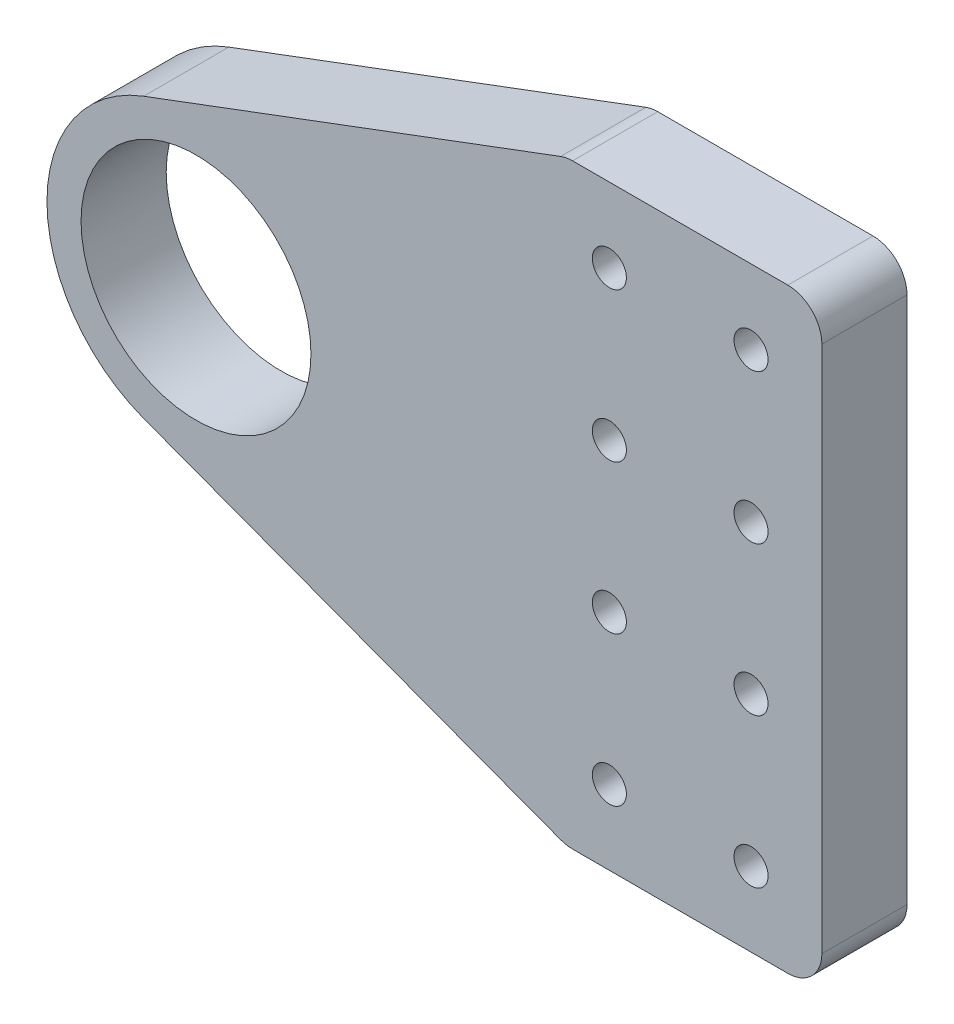
from build123d import *

# Parameters (mm, degrees)
SKETCH1_R           = 17.145
SKETCH1_R_2         = 2.54
BOSS_EXTRUDE1_DEPTH = 12.7


with BuildPart() as part:
    # Sketch1 → Boss-Extrude1 (new body)
    with BuildSketch(Plane.XY):
        with BuildLine():
            Line((877.221063467, -292.1), (909.32, -292.1))
            ThreePointArc((909.32, -292.1), (912.912102448, -290.612102448), (914.4, -287.02))
            Line((914.4, -287.02), (914.4, -208.28))
            ThreePointArc((914.4, -208.28), (912.912102448, -204.687897552), (909.32, -203.2))
            Line((909.32, -203.2), (877.221063467, -203.2))
            ThreePointArc((877.221063467, -203.2), (876.314776159, -203.281495892), (875.437567077, -203.523368773))
            Line((875.437567077, -203.523368773), (813.252203296, -226.839738382))
            ThreePointArc((813.252203296, -226.839738382), (798.83, -247.65), (813.252203296, -268.460261618))
            Line((813.252203296, -268.460261618), (875.437567077, -291.776631227))
            ThreePointArc((875.437567077, -291.776631227), (876.314776159, -292.018504108), (877.221063467, -292.1))
        make_face()
        with Locations((821.055, -247.65)):
            Circle(SKETCH1_R, mode=Mode.SUBTRACT)
        with Locations((903.835265867, -214.298026916)):
            Circle(SKETCH1_R_2, mode=Mode.SUBTRACT)
        with Locations(Location((882.7057976, -214.298026916, 0), (0, 0, 180))):
            Circle(SKETCH1_R_2, mode=Mode.SUBTRACT)
        with Locations((882.7057976, -236.551973084)):
            Circle(SKETCH1_R_2, mode=Mode.SUBTRACT)
        with Locations(Location((903.835265867, -236.551973084, 0), (0, 0, 180))):
            Circle(SKETCH1_R_2, mode=Mode.SUBTRACT)
        with Locations(Location((882.7057976, -258.748026916, 0), (0, 0, 180))):
            Circle(SKETCH1_R_2, mode=Mode.SUBTRACT)
        with Locations((882.7057976, -281.001973084)):
            Circle(SKETCH1_R_2, mode=Mode.SUBTRACT)
        with Locations((903.835265867, -258.748026916)):
            Circle(SKETCH1_R_2, mode=Mode.SUBTRACT)
        with Locations(Location((903.835265867, -281.001973084, 0), (0, 0, 180))):
            Circle(SKETCH1_R_2, mode=Mode.SUBTRACT)
    extrude(amount=BOSS_EXTRUDE1_DEPTH)


solid = part.part
